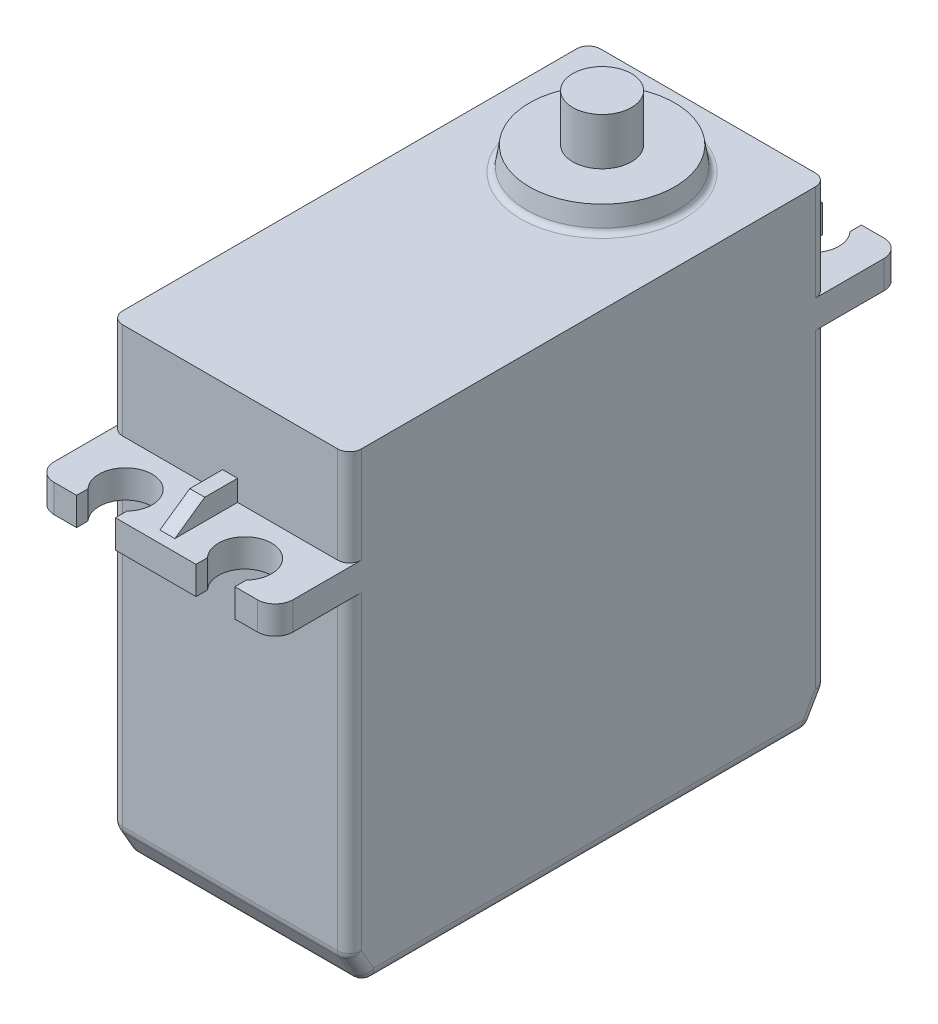
from build123d import *
from OCP.BRepFilletAPI import BRepFilletAPI_MakeChamfer

# Parameters (mm, degrees)
SKETCH1_W          = 20.32
SKETCH1_H          = 40.64
EXTRUDE1_DEPTH     = 29.2
SKETCH2_W          = 20.32
SKETCH2_H          = 40.64
EXTRUDE2_DEPTH     = 2.38125
SKETCH3_W          = 20.32
SKETCH3_H          = 40.64
EXTRUDE3_DEPTH     = 8.2
EXTRUDE6_DEPTH     = 0.635
CHAMFER2_SIZE      = 2.54
CHAMFER2_SIZE2     = 1.466469684
FILLET1_R          = 1.016
FILLET2_R          = 1.524
SKETCH9_W          = 6.35
SKETCH9_H          = 2.54
EXTRUDE8_DEPTH     = 2.38125
SKETCH10_W         = 5.08
SKETCH10_H         = 1.27
CUT_EXTRUDE1_DEPTH = 2.38125
SKETCH_1_R         = 6.5
EXTRUDE_1_DEPTH    = 2
EXTRUDE_1_TAPER    = 9
FILLET_1_R         = 0.5
SKETCH_2_R         = 2.5
EXTRUDE_2_DEPTH    = 4


with BuildPart() as part:
    # Sketch1 → Extrude1 (new body)
    with BuildSketch(Plane(origin=(0, 0, 0), x_dir=(1, 0, 0), z_dir=(0, 1, 0))):
        with Locations((0, -10.16)):
            Rectangle(SKETCH1_W, SKETCH1_H)
    extrude(amount=EXTRUDE1_DEPTH)

    # Sketch2 → Extrude2 (add)
    with BuildSketch(Plane(origin=(0, 29.2, 0), x_dir=(-1, 0, 0), z_dir=(0, 1, 0))):
        with Locations((0, 10.16)):
            Rectangle(SKETCH2_W, SKETCH2_H)
        with BuildLine():
            ThreePointArc((6.731, -15.51418631), (5.08, -11.7094), (3.429, -15.51418631))
            Line((3.429, -15.51418631), (3.429, -16.4846))
            Line((3.429, -16.4846), (-3.429, -16.4846))
            Line((-3.429, -16.4846), (-3.429, -15.51418631))
            ThreePointArc((-3.429, -15.51418631), (-5.08, -11.7094), (-6.731, -15.51418631))
            Line((-6.731, -15.51418631), (-6.731, -16.4846))
            Line((-6.731, -16.4846), (-10.16, -16.4846))
            Line((-10.16, -16.4846), (-10.16, -10.16))
            Line((-10.16, -10.16), (10.16, -10.16))
            Line((10.16, -10.16), (10.16, -16.4846))
            Line((10.16, -16.4846), (6.731, -16.4846))
            Line((6.731, -16.4846), (6.731, -15.51418631))
        make_face()
        with BuildLine():
            ThreePointArc((-6.731, 35.83418631), (-5.08, 32.0294), (-3.429, 35.83418631))
            Line((-3.429, 35.83418631), (-3.429, 36.8046))
            Line((-3.429, 36.8046), (3.429, 36.8046))
            Line((3.429, 36.8046), (3.429, 35.83418631))
            ThreePointArc((3.429, 35.83418631), (5.08, 32.0294), (6.731, 35.83418631))
            Line((6.731, 35.83418631), (6.731, 36.8046))
            Line((6.731, 36.8046), (10.16, 36.8046))
            Line((10.16, 36.8046), (10.16, 30.48))
            Line((10.16, 30.48), (-10.16, 30.48))
            Line((-10.16, 30.48), (-10.16, 36.8046))
            Line((-10.16, 36.8046), (-6.731, 36.8046))
            Line((-6.731, 36.8046), (-6.731, 35.83418631))
        make_face()
    extrude(amount=EXTRUDE2_DEPTH)

    # Sketch3 → Extrude3 (add)
    with BuildSketch(Plane(origin=(0, 31.58125, 0), x_dir=(-1, 0, 0), z_dir=(0, 1, 0))):
        with Locations((0, 10.16)):
            Rectangle(SKETCH3_W, SKETCH3_H)
    extrude(amount=EXTRUDE3_DEPTH)

    # Sketch7 → Extrude6 (add, symmetric)
    with BuildSketch(Plane(origin=(0, 0, 0), x_dir=(0, 0, -1), z_dir=(1, 0, 0))):
        Polygon((15.494, 31.58125), (12.954, 33.35925), (10.16, 33.35925), (10.16, 31.58125), align=None)
    extrude6 = extrude(amount=EXTRUDE6_DEPTH, both=True)

    # Mirror1: Extrude6 across plane
    add(extrude6.mirror(Plane(origin=(0, 0, 10.16), x_dir=(1, 0, 0), z_dir=(0, 0, -1))))

    # Chamfer2: one chamfer whose edges measure the first distance from different faces: ONE call of the kernel's chamfer builder (chamfer() names one face for all edges)
    chamfer2_edges_1 = [part.edges().sort_by_distance(p)[0] for p in [
        (0, 0, -10.16),
    ]]
    chamfer2_side_1 = [part.faces().sort_by_distance(p)[0] for p in [
        (0, 14.6, -10.16),
    ]]
    chamfer2_edges_2 = [part.edges().sort_by_distance(p)[0] for p in [
        (0, 0, 30.48),
    ]]
    chamfer2_side_2 = [part.faces().sort_by_distance(p)[0] for p in [
        (0, 14.6, 30.48),
    ]]
    chamfer2 = BRepFilletAPI_MakeChamfer(part.part.solid().wrapped)
    for e in chamfer2_edges_1:
        chamfer2.Add(CHAMFER2_SIZE, CHAMFER2_SIZE2, e.wrapped, chamfer2_side_1[0].wrapped)  # the first distance lies on this face
    for e in chamfer2_edges_2:
        chamfer2.Add(CHAMFER2_SIZE, CHAMFER2_SIZE2, e.wrapped, chamfer2_side_2[0].wrapped)  # the first distance lies on this face
    add(Compound.cast(chamfer2.Shape()), mode=Mode.REPLACE)

    # Fillet1
    fillet1_edges = [part.edges().sort_by_distance(p)[0] for p in [
        (-10.16, 35.68125, -10.16),
        (10.16, 35.68125, -10.16),
        (10.16, 35.68125, 30.48),
        (10.16, 0, 10.16),
        (10.16, 1.27, -9.426765158),
        (10.16, 15.87, -10.16),
        (0, 0, -8.693530316),
        (0, 2.54, -10.16),
        (-10.16, 15.87, -10.16),
        (-10.16, 1.27, -9.426765158),
        (10.16, 15.87, 30.48),
        (10.16, 1.27, 29.746765158),
        (0, 2.54, 30.48),
        (-10.16, 0, 10.16),
        (0, 0, 29.013530316),
        (-10.16, 1.27, 29.746765158),
        (-10.16, 15.87, 30.48),
        (-10.16, 35.68125, 30.48),
    ]]
    fillet(fillet1_edges, radius=FILLET1_R)

    # Fillet2
    fillet2_edges = [part.edges().sort_by_distance(p)[0] for p in [
        (-10.16, 30.390625, 36.8046),
        (10.16, 30.390625, 36.8046),
        (-10.16, 30.390625, -16.4846),
        (10.16, 30.390625, -16.4846),
    ]]
    fillet(fillet2_edges, radius=FILLET2_R)

    # Sketch9 → Extrude8 (add)
    with BuildSketch(Plane(origin=(0, 0, -10.16), x_dir=(-1, 0, 0), z_dir=(0, 0, -1))):
        with Locations((0, 11.27)):
            Rectangle(SKETCH9_W, SKETCH9_H)
    extrude(amount=EXTRUDE8_DEPTH)

    # Sketch10 → Cut-Extrude1 (cut)
    with BuildSketch(Plane(origin=(0, 0, -12.54125), x_dir=(-1, 0, 0), z_dir=(0, 0, -1))):
        with Locations((0, 11.27)):
            Rectangle(SKETCH10_W, SKETCH10_H)
    extrude(amount=-CUT_EXTRUDE1_DEPTH, mode=Mode.SUBTRACT)

    # Эскиз1 → Вытянуть1 (add)
    with BuildSketch(Plane(origin=(0, 39.78125, 0), x_dir=(1, 0, 0), z_dir=(0, 1, 0))):
        with Locations((0, 1.16)):
            Circle(SKETCH_1_R)
    extrude(amount=EXTRUDE_1_DEPTH, taper=EXTRUDE_1_TAPER)

    # Скругление1
    fillet_1_edges = [part.edges().sort_by_distance(p)[0] for p in [
        (-6.5, 39.78125, -1.16),
    ]]
    fillet(fillet_1_edges, radius=FILLET_1_R)

    # Эскиз2 → Вытянуть2 (add)
    with BuildSketch(Plane(origin=(0, 41.78125, 0), x_dir=(1, 0, 0), z_dir=(0, 1, 0))):
        with Locations(Location((0, 1.16, 0), (0, 0, 270))):
            Circle(SKETCH_2_R)
    extrude(amount=EXTRUDE_2_DEPTH)


solid = part.part
